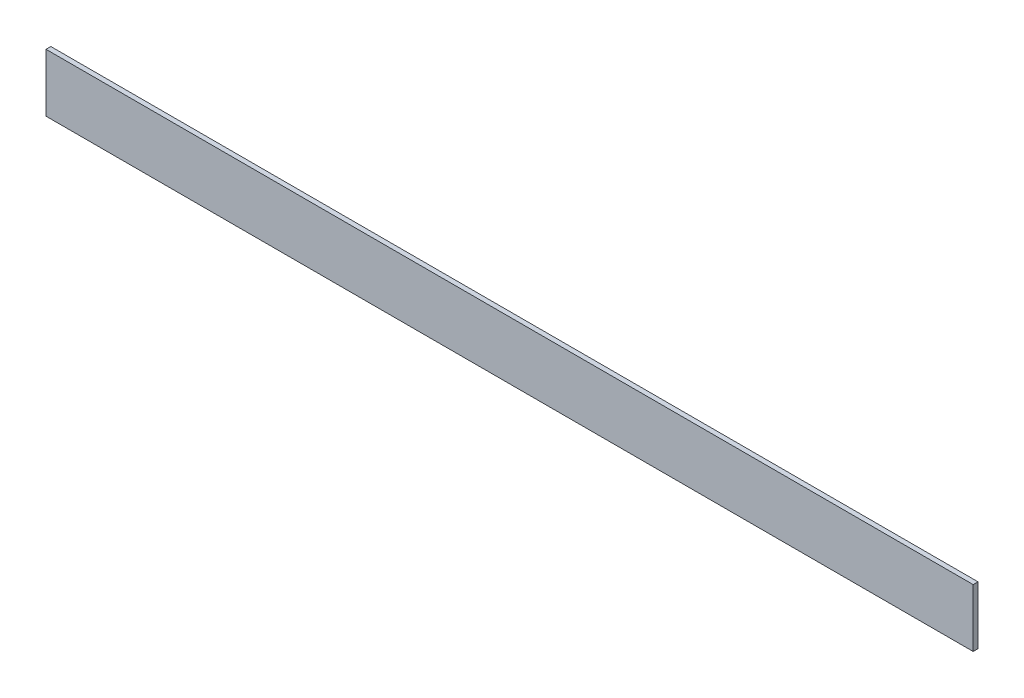
from build123d import *

# Parameters (mm, degrees)
SKETCH1_W           = 960
SKETCH1_H           = 60
BOSS_EXTRUDE1_DEPTH = 5


with BuildPart() as part:
    # Sketch1 → Boss-Extrude1 (new body)
    with BuildSketch(Plane.XY):
        Rectangle(SKETCH1_W, SKETCH1_H)
    extrude(amount=BOSS_EXTRUDE1_DEPTH)


solid = part.part
